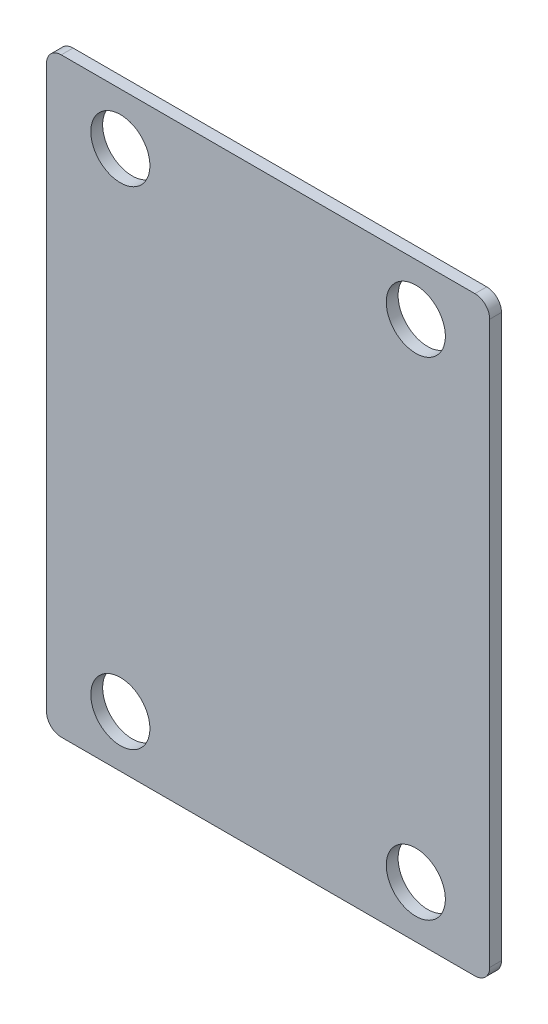
from build123d import *

# Parameters (mm, degrees)
SKETCH_1_W      = 60
SKETCH_1_H      = 80
SKETCH_1_R      = 4
EXTRUDE_1_DEPTH = 1.6
FILLET_1_R      = 2


with BuildPart() as part:
    # 草图1 → 凸台-拉伸1 (new body)
    with BuildSketch(Plane.XY):
        Rectangle(SKETCH_1_W, SKETCH_1_H)
        with Locations((-20, 33)):
            Circle(SKETCH_1_R, mode=Mode.SUBTRACT)
        with Locations(Location((20, 33, 0), (0, 0, 180))):
            Circle(SKETCH_1_R, mode=Mode.SUBTRACT)
        with Locations((20, -33)):
            Circle(SKETCH_1_R, mode=Mode.SUBTRACT)
        with Locations(Location((-20, -33, 0), (0, 0, 180))):
            Circle(SKETCH_1_R, mode=Mode.SUBTRACT)
    extrude(amount=EXTRUDE_1_DEPTH)

    # 圆角1
    fillet_1_edges = [part.edges().sort_by_distance(p)[0] for p in [
        (30, -40, 0.8),
        (-30, -40, 0.8),
        (-30, 40, 0.8),
        (30, 40, 0.8),
    ]]
    fillet(fillet_1_edges, radius=FILLET_1_R)


solid = part.part
